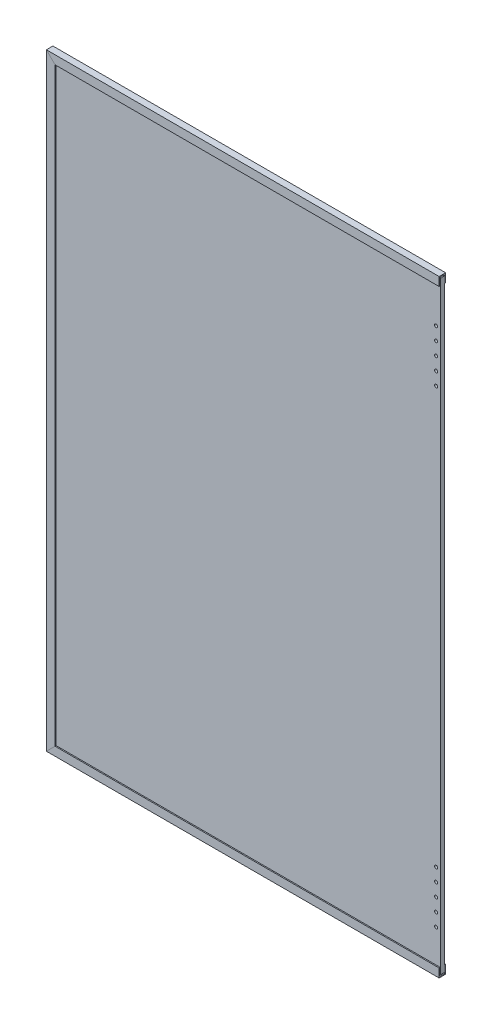
from build123d import *

# Parameters (mm, degrees)
SKETCH2_W                             = 574.675
SKETCH2_H                             = 889
FRAME_OUTER_DIMENSIONS_DEPTH          = 4.7625
SKETCH3_W                             = 561.975
SKETCH3_H                             = 863.6
FRAME_INNER_DIMENSIONS_DEPTH          = 1050.71569395
FRAME_PROFILE_DEPTH                   = 3.175
FRAME_PROFILE_DEPTH_BACK              = 3.175
SKETCH4_W                             = 573.0875
SKETCH4_H                             = 885.825
FRAME_SECTION_SPLIT_SURFACE_1_1_BACK  = 1059.614
FRAME_SECTION_SPLIT_SURFACE_1_1_DEPTH = 2119.228
FRAME_SECTION_SPLIT_SURFACE_1_2_BACK  = 1059.614
FRAME_SECTION_SPLIT_SURFACE_1_2_DEPTH = 2119.228
FRAME_SECTION_SPLIT_SURFACE_2_3_BACK  = 1059.614
FRAME_SECTION_SPLIT_SURFACE_2_3_DEPTH = 2119.228
FRAME_SECTION_SPLIT_SURFACE_2_4_BACK  = 1059.614
FRAME_SECTION_SPLIT_SURFACE_2_4_DEPTH = 2119.228
SKETCH5_W                             = 571.5
SKETCH5_H                             = 882.65
DOOR_PANEL_DEPTH                      = 2.794
SKETCH9_W                             = 2.2479
SKETCH9_H                             = 7.5565
F_8_CLEARANCE_HOLE1_AT_2_COUNT        = 2
F_8_CLEARANCE_HOLE1_AT_2_PITCH        = 19.05
F_8_CLEARANCE_HOLE1_AT_3_COUNT        = 2
F_8_CLEARANCE_HOLE1_AT_3_PITCH        = 38.1
F_8_CLEARANCE_HOLE1_AT_4_COUNT        = 2
F_8_CLEARANCE_HOLE1_AT_4_PITCH        = 57.15
F_8_CLEARANCE_HOLE1_AT_5_COUNT        = 2
F_8_CLEARANCE_HOLE1_AT_5_PITCH        = 76.2
F_8_CLEARANCE_HOLE1_AT_6_COUNT        = 2
F_8_CLEARANCE_HOLE1_AT_6_PITCH        = 704.85
F_8_CLEARANCE_HOLE1_AT_7_COUNT        = 2
F_8_CLEARANCE_HOLE1_AT_7_PITCH        = 723.9
F_8_CLEARANCE_HOLE1_AT_8_COUNT        = 2
F_8_CLEARANCE_HOLE1_AT_8_PITCH        = 742.95
F_8_CLEARANCE_HOLE1_AT_9_COUNT        = 2
F_8_CLEARANCE_HOLE1_AT_9_PITCH        = 762
F_8_CLEARANCE_HOLE1_AT_10_COUNT       = 2
F_8_CLEARANCE_HOLE1_AT_10_PITCH       = 685.8


with BuildPart() as part:
    # Sketch2 → Frame outer dimensions (new, symmetric)
    with BuildSketch(Plane.XY):
        with Locations((290.5125, 431.8)):
            Rectangle(SKETCH2_W, SKETCH2_H)
    extrude(amount=FRAME_OUTER_DIMENSIONS_DEPTH, both=True)

    # Sketch3 → Frame inner dimensions (cut, through all)
    with BuildSketch(Plane.XY.offset(4.7625)):
        with Locations((296.8625, 431.8)):
            Rectangle(SKETCH3_W, SKETCH3_H)
    extrude(amount=-FRAME_INNER_DIMENSIONS_DEPTH, mode=Mode.SUBTRACT)

    # Sketch4 → Frame profile (cut, two sides: drawn at the far end of the back side and taken through both)
    with BuildSketch(Plane.XY.offset(-FRAME_PROFILE_DEPTH_BACK)):
        with Locations((291.30625, 431.8)):
            Rectangle(SKETCH4_W, SKETCH4_H)
    extrude(amount=FRAME_PROFILE_DEPTH + FRAME_PROFILE_DEPTH_BACK, mode=Mode.SUBTRACT)


with BuildPart() as body_2:
    # Frame section split: the piece behind the surface
    add(part.part)
    # Frame section split surface 1: a surface, the sketch's curves swept straight by 2119.228 mm
    with BuildLine(Plane.XY.offset(4.7625).offset(-FRAME_SECTION_SPLIT_SURFACE_1_1_BACK), mode=Mode.PRIVATE) as frame_section_split_surface_1_1_path:
        Line((3.175, 876.3), (15.875, 863.6))
    frame_section_split_surface_1_1 = Shell.extrude(frame_section_split_surface_1_1_path.wire(), (0 * FRAME_SECTION_SPLIT_SURFACE_1_1_DEPTH, 0 * FRAME_SECTION_SPLIT_SURFACE_1_1_DEPTH, 1 * FRAME_SECTION_SPLIT_SURFACE_1_1_DEPTH))
    split(bisect_by=frame_section_split_surface_1_1, keep=Keep.BOTTOM)


with BuildPart() as part_1:
    add(part.part)

    # Frame section split: split by a surface, the side it looks to stays
    # Frame section split surface 1: a surface, the sketch's curves swept straight by 2119.228 mm
    with BuildLine(Plane.XY.offset(4.7625).offset(-FRAME_SECTION_SPLIT_SURFACE_1_2_BACK), mode=Mode.PRIVATE) as frame_section_split_surface_1_2_path:
        Line((3.175, 876.3), (15.875, 863.6))
    frame_section_split_surface_1_2 = Shell.extrude(frame_section_split_surface_1_2_path.wire(), (0 * FRAME_SECTION_SPLIT_SURFACE_1_2_DEPTH, 0 * FRAME_SECTION_SPLIT_SURFACE_1_2_DEPTH, 1 * FRAME_SECTION_SPLIT_SURFACE_1_2_DEPTH))
    split(bisect_by=frame_section_split_surface_1_2, keep=Keep.TOP)


with BuildPart() as body_3:
    # Frame section split 2 body 2: the piece behind the surface
    add(body_2.part)
    # Frame section split surface 2: a surface, the sketch's curves swept straight by 2119.228 mm
    with BuildLine(Plane.XY.offset(4.7625).offset(-FRAME_SECTION_SPLIT_SURFACE_2_3_BACK), mode=Mode.PRIVATE) as frame_section_split_surface_2_3_path:
        Line((3.175, -12.7), (15.875, 0))
    frame_section_split_surface_2_3 = Shell.extrude(frame_section_split_surface_2_3_path.wire(), (0 * FRAME_SECTION_SPLIT_SURFACE_2_3_DEPTH, 0 * FRAME_SECTION_SPLIT_SURFACE_2_3_DEPTH, 1 * FRAME_SECTION_SPLIT_SURFACE_2_3_DEPTH))
    split(bisect_by=frame_section_split_surface_2_3, keep=Keep.BOTTOM)


with BuildPart() as body_2_1:
    add(body_2.part)

    # Frame section split 2 body 2: split by a surface, the side it looks to stays
    # Frame section split surface 2: a surface, the sketch's curves swept straight by 2119.228 mm
    with BuildLine(Plane.XY.offset(4.7625).offset(-FRAME_SECTION_SPLIT_SURFACE_2_4_BACK), mode=Mode.PRIVATE) as frame_section_split_surface_2_4_path:
        Line((3.175, -12.7), (15.875, 0))
    frame_section_split_surface_2_4 = Shell.extrude(frame_section_split_surface_2_4_path.wire(), (0 * FRAME_SECTION_SPLIT_SURFACE_2_4_DEPTH, 0 * FRAME_SECTION_SPLIT_SURFACE_2_4_DEPTH, 1 * FRAME_SECTION_SPLIT_SURFACE_2_4_DEPTH))
    split(bisect_by=frame_section_split_surface_2_4, keep=Keep.TOP)


with BuildPart() as body_4:
    # Sketch5 → Door panel (new, symmetric)
    with BuildSketch(Plane.XY):
        with Locations((292.1, 431.8)):
            Rectangle(SKETCH5_W, SKETCH5_H)
    extrude(amount=DOOR_PANEL_DEPTH, both=True)

    # Sketch9 → #8 Clearance Hole1 (revolve, cut)
    with BuildSketch(Plane(origin=(571.5, 47.625, 2.794), x_dir=(0, -1, 0), z_dir=(1, 0, 0))):
        with Locations((1.12395, 3.77825)):
            Rectangle(SKETCH9_W, SKETCH9_H)
    f_8_clearance_hole1 = revolve(axis=Axis((571.5, 47.625, 9.144), (0, 0, -1)), mode=Mode.SUBTRACT)

    # #8 Clearance Hole1 at 2: #8 Clearance Hole1 ×2
    with Locations(*[(0, i * F_8_CLEARANCE_HOLE1_AT_2_PITCH, 0) for i in range(1, F_8_CLEARANCE_HOLE1_AT_2_COUNT)]):
        add(f_8_clearance_hole1, mode=Mode.SUBTRACT)

    # #8 Clearance Hole1 at 3: #8 Clearance Hole1 ×2
    with Locations(*[(0, i * F_8_CLEARANCE_HOLE1_AT_3_PITCH, 0) for i in range(1, F_8_CLEARANCE_HOLE1_AT_3_COUNT)]):
        add(f_8_clearance_hole1, mode=Mode.SUBTRACT)

    # #8 Clearance Hole1 at 4: #8 Clearance Hole1 ×2
    with Locations(*[(0, i * F_8_CLEARANCE_HOLE1_AT_4_PITCH, 0) for i in range(1, F_8_CLEARANCE_HOLE1_AT_4_COUNT)]):
        add(f_8_clearance_hole1, mode=Mode.SUBTRACT)

    # #8 Clearance Hole1 at 5: #8 Clearance Hole1 ×2
    with Locations(*[(0, i * F_8_CLEARANCE_HOLE1_AT_5_PITCH, 0) for i in range(1, F_8_CLEARANCE_HOLE1_AT_5_COUNT)]):
        add(f_8_clearance_hole1, mode=Mode.SUBTRACT)

    # #8 Clearance Hole1 at 6: #8 Clearance Hole1 ×2
    with Locations(*[(0, i * F_8_CLEARANCE_HOLE1_AT_6_PITCH, 0) for i in range(1, F_8_CLEARANCE_HOLE1_AT_6_COUNT)]):
        add(f_8_clearance_hole1, mode=Mode.SUBTRACT)

    # #8 Clearance Hole1 at 7: #8 Clearance Hole1 ×2
    with Locations(*[(0, i * F_8_CLEARANCE_HOLE1_AT_7_PITCH, 0) for i in range(1, F_8_CLEARANCE_HOLE1_AT_7_COUNT)]):
        add(f_8_clearance_hole1, mode=Mode.SUBTRACT)

    # #8 Clearance Hole1 at 8: #8 Clearance Hole1 ×2
    with Locations(*[(0, i * F_8_CLEARANCE_HOLE1_AT_8_PITCH, 0) for i in range(1, F_8_CLEARANCE_HOLE1_AT_8_COUNT)]):
        add(f_8_clearance_hole1, mode=Mode.SUBTRACT)

    # #8 Clearance Hole1 at 9: #8 Clearance Hole1 ×2
    with Locations(*[(0, i * F_8_CLEARANCE_HOLE1_AT_9_PITCH, 0) for i in range(1, F_8_CLEARANCE_HOLE1_AT_9_COUNT)]):
        add(f_8_clearance_hole1, mode=Mode.SUBTRACT)

    # #8 Clearance Hole1 at 10: #8 Clearance Hole1 ×2
    with Locations(*[(0, i * F_8_CLEARANCE_HOLE1_AT_10_PITCH, 0) for i in range(1, F_8_CLEARANCE_HOLE1_AT_10_COUNT)]):
        add(f_8_clearance_hole1, mode=Mode.SUBTRACT)


solid = Compound([part_1.part, body_3.part, body_2_1.part, body_4.part])
